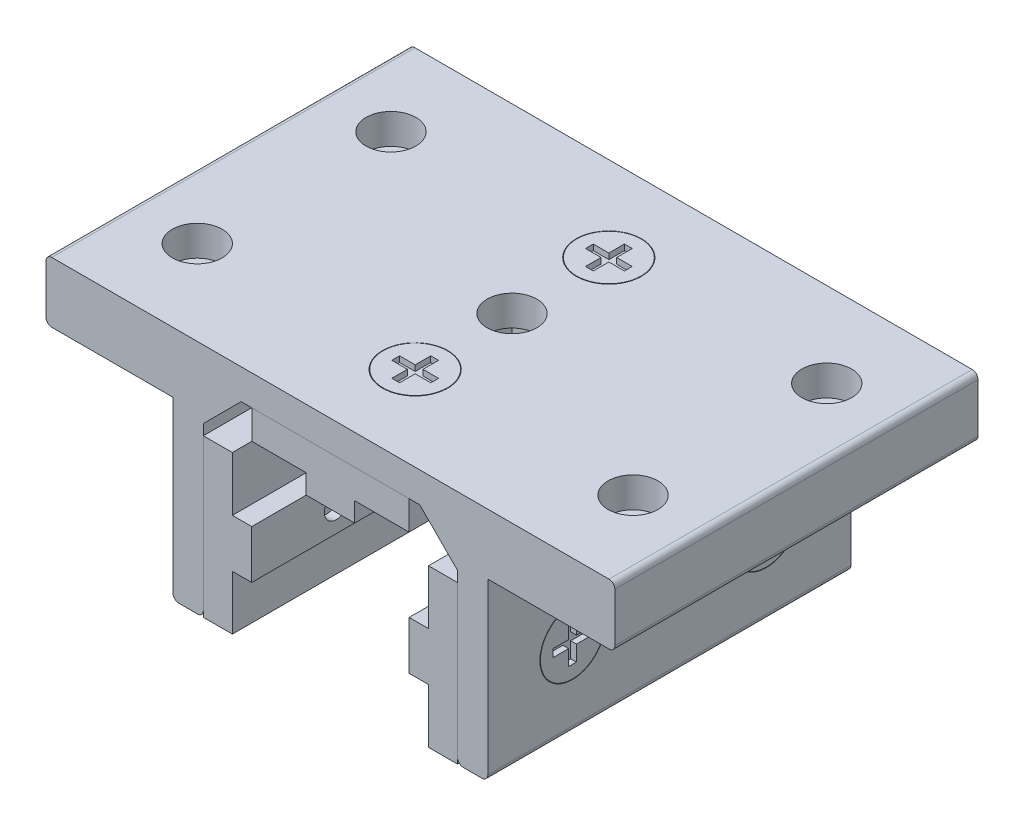
from build123d import *

# Parameters (mm, degrees)
BOSS_EXTRUDE1_DEPTH      = 23.8125
BOSS_EXTRUDE1_DEPTH_BACK = 23.8125
BOSS_EXTRUDE2_START      = -23.8125
BOSS_EXTRUDE2_DEPTH      = 47.625
CUT_EXTRUDE1_DEPTH       = 47.880611918
CUT_EXTRUDE1_DEPTH_BACK  = 47.880611918
SKETCH6_R                = 2.5527
SKETCH6_R_2              = 3.2639
SKETCH7_R                = 1.5875
SKETCH7_W                = 6.5278
SKETCH7_H                = 6.5278
CUT_EXTRUDE2_DEPTH       = 47.880611918
SKETCH8_R                = 2.5527
SKETCH8_R_2              = 3.2639
CUT_EXTRUDE3_DEPTH       = 3.96875
CHAMFER1_SIZE            = 1.7272
CUT_EXTRUDE5_DEPTH       = 0.756616
LPATTERN1_COUNT          = 2
LPATTERN1_PITCH          = 25.4
CIRPATTERN1_COUNT        = 3
CIRPATTERN1_ANGLE        = 180
FILLET1_R                = 0.762


with BuildPart() as part:
    # Sketch4 → Boss-Extrude1 (new, two sides: drawn at the far end of the back side and taken through both)
    with BuildSketch(Plane.XY.offset(-BOSS_EXTRUDE1_DEPTH_BACK)):
        Polygon((-20.6375, -15.47495), (-16.66875, -15.47495), (-16.66875, 6.5389125), (-11.7078125, 11.49985), (11.7078125, 11.49985), (16.66875, 6.5389125), (16.66875, -15.47495), (20.6375, -15.47495), (20.6375, 7.5311), (37.2999, 7.5311), (37.2999, 15.4686), (-37.2999, 15.4686), (-37.2999, 7.5311), (-20.6375, 7.5311), align=None)
    extrude(amount=BOSS_EXTRUDE1_DEPTH + BOSS_EXTRUDE1_DEPTH_BACK)

    # Sketch6 → Cut-Extrude1 (cut, two sides: drawn at the far end of the back side and taken through both)
    with BuildSketch(Plane(origin=(0, 0, 0), x_dir=(0, 0, -1), z_dir=(1, 0, 0)).offset(-CUT_EXTRUDE1_DEPTH_BACK)):
        with Locations((-12.7, -5.16255)):
            Circle(SKETCH6_R)
        with Locations((0, -5.16255)):
            Circle(SKETCH6_R_2)
        with Locations((12.7, -5.16255)):
            Circle(SKETCH6_R)
    extrude(amount=CUT_EXTRUDE1_DEPTH + CUT_EXTRUDE1_DEPTH_BACK, mode=Mode.SUBTRACT)

    # Sketch8 → Cut-Extrude3 (cut)
    with BuildSketch(Plane(origin=(0, 15.4686, 0), x_dir=(1, 0, 0), z_dir=(0, 1, 0))):
        with Locations(Location((0, 12.7, 0), (0, 0, 270))):
            Circle(SKETCH8_R)
        with Locations(Location((0, -12.7, 0), (0, 0, 270))):
            Circle(SKETCH8_R)
        with Locations(Location((28.575, -12.7, 0), (0, 0, 270))):
            Circle(SKETCH8_R_2)
        with Locations(Location((28.575, 12.7, 0), (0, 0, 270))):
            Circle(SKETCH8_R_2)
        with Locations(Location((0, 0, 0), (0, 0, 270))):
            Circle(SKETCH8_R_2)
        with Locations(Location((-28.575, -12.7, 0), (0, 0, 270))):
            Circle(SKETCH8_R_2)
        with Locations(Location((-28.575, 12.7, 0), (0, 0, 270))):
            Circle(SKETCH8_R_2)
    extrude(amount=-CUT_EXTRUDE3_DEPTH, mode=Mode.SUBTRACT)

    # Chamfer1
    chamfer1_edges = [part.edges().sort_by_distance(p)[0] for p in [
        (0, 15.4686, 10.1473),
        (0, 15.4686, -15.2527),
        (-20.6375, -5.16255, 15.2527),
        (20.6375, -5.16255, 15.2527),
        (-20.6375, -5.16255, -10.1473),
        (20.6375, -5.16255, -10.1473),
    ]]
    chamfer(chamfer1_edges, length=CHAMFER1_SIZE)

    # Fillet1
    fillet1_edges = [part.edges().sort_by_distance(p)[0] for p in [
        (-37.2999, 7.5311, 0),
        (-37.2999, 15.4686, 0),
        (37.2999, 15.4686, 0),
        (37.2999, 7.5311, 0),
        (20.6375, -15.47495, 0),
        (16.66875, -15.47495, 0),
        (-16.66875, -15.47495, 0),
        (-20.6375, -15.47495, 0),
    ]]
    fillet(fillet1_edges, radius=FILLET1_R)


with BuildPart() as body_2:
    # Sketch5 → Boss-Extrude2 (new body)
    with BuildSketch(Plane.XY.offset(BOSS_EXTRUDE2_START)):
        Polygon((-16.66875, 5.14985), (-16.66875, -15.47495), (-12.85875, -15.47495), (-12.85875, -8.33755), (-10.31875, -8.33755), (-10.31875, -1.98755), (-12.85875, -1.98755), (-12.85875, 5.14985), align=None)
    extrude(amount=BOSS_EXTRUDE2_DEPTH)

    # Sketch7 → Cut-Extrude2 (cut, through all)
    with BuildSketch(Plane(origin=(0, 0, 0), x_dir=(0, 0, -1), z_dir=(1, 0, 0))):
        with Locations(Location((-12.7, -5.16255, 0), (0, 0, 90))):
            Circle(SKETCH7_R)
        with Locations(Location((12.7, -5.16255, 0), (0, 0, 90))):
            Circle(SKETCH7_R)
        with Locations((0, -5.16255)):
            Rectangle(SKETCH7_W, SKETCH7_H)
    extrude(amount=-CUT_EXTRUDE2_DEPTH, mode=Mode.SUBTRACT)


with BuildPart() as body_3:
    # Sketch12 → Revolve1 (revolve)
    with BuildSketch(Plane.XY.offset(12.7)):
        Polygon((-20.6375, -0.94615), (-20.6375, -5.16255), (-11.58875, -5.16255), (-11.58875, -2.74955), (-19.124267725, -2.74955), align=None)
    revolve(axis=Axis((-20.6375, -5.16255, 12.7), (1, 0, 0)))

    # Sketch13 → Cut-Extrude5 (cut)
    with BuildSketch(Plane.ZY.offset(20.6375)):
        Polygon((13.21054, -7.71525), (12.18946, -7.71525), (12.18946, -5.67309), (10.1473, -5.67309), (10.1473, -4.65201), (12.18946, -4.65201), (12.18946, -2.60985), (13.21054, -2.60985), (13.21054, -4.65201), (15.2527, -4.65201), (15.2527, -5.67309), (13.21054, -5.67309), align=None)
    extrude(amount=-CUT_EXTRUDE5_DEPTH, mode=Mode.SUBTRACT)


with BuildPart() as lpattern1_1:
    # LPattern1: pattern copy
    add(body_3.part.moved(Location(Vector(0, 0, -1) * (1 * LPATTERN1_PITCH))))


with BuildPart() as cirpattern1_1:
    # CirPattern1: pattern copy
    add(body_2.part.rotate(Axis((0, -5.16255, 0), (0, 0, -1)), 1 * CIRPATTERN1_ANGLE / (CIRPATTERN1_COUNT - 1)))


with BuildPart() as cirpattern1_2:
    # CirPattern1: pattern copy
    add(body_2.part.rotate(Axis((0, -5.16255, 0), (0, 0, -1)), 2 * CIRPATTERN1_ANGLE / (CIRPATTERN1_COUNT - 1)))


with BuildPart() as cirpattern1_3:
    # CirPattern1: pattern copy
    add(body_3.part.rotate(Axis((0, -5.16255, 0), (0, 0, -1)), 1 * CIRPATTERN1_ANGLE / (CIRPATTERN1_COUNT - 1)))


with BuildPart() as cirpattern1_4:
    # CirPattern1: pattern copy
    add(body_3.part.rotate(Axis((0, -5.16255, 0), (0, 0, -1)), 2 * CIRPATTERN1_ANGLE / (CIRPATTERN1_COUNT - 1)))


with BuildPart() as cirpattern1_5:
    # CirPattern1: pattern copy
    add(lpattern1_1.part.rotate(Axis((0, -5.16255, 0), (0, 0, -1)), 1 * CIRPATTERN1_ANGLE / (CIRPATTERN1_COUNT - 1)))


with BuildPart() as cirpattern1_6:
    # CirPattern1: pattern copy
    add(lpattern1_1.part.rotate(Axis((0, -5.16255, 0), (0, 0, -1)), 2 * CIRPATTERN1_ANGLE / (CIRPATTERN1_COUNT - 1)))


solid = Compound([part.part, body_2.part, body_3.part, lpattern1_1.part, cirpattern1_1.part, cirpattern1_2.part, cirpattern1_3.part, cirpattern1_4.part, cirpattern1_5.part, cirpattern1_6.part])
